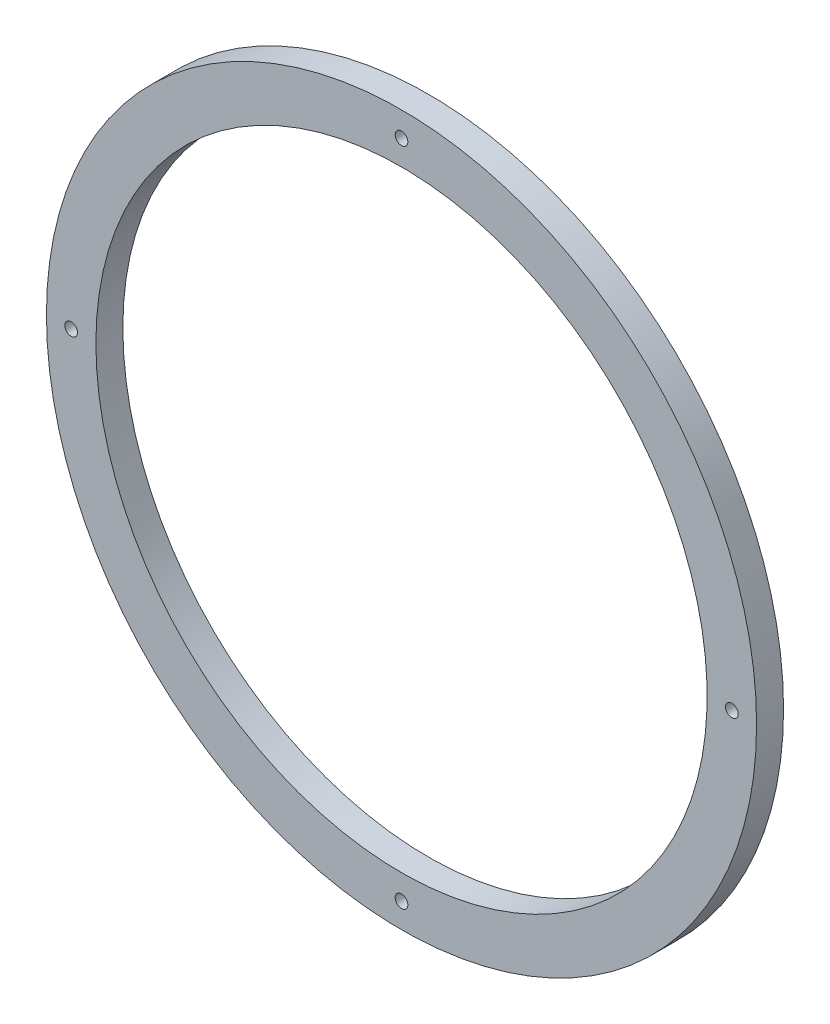
from build123d import *

# Parameters (mm, degrees)
SKETCH1_R           = 100.33
SKETCH1_R_2         = 86.36
SKETCH1_R_3         = 1.7859375
BOSS_EXTRUDE1_DEPTH = 7.62


with BuildPart() as part:
    # Sketch1 → Boss-Extrude1 (new body)
    with BuildSketch(Plane.XY):
        with Locations(Location((0, 0, 0), (0, 0, 180))):
            Circle(SKETCH1_R)
        with Locations(Location((0, 0, 0), (0, 0, 180))):
            Circle(SKETCH1_R_2, mode=Mode.SUBTRACT)
        with Locations(Location((0, 93.345, 0), (0, 0, 180))):
            Circle(SKETCH1_R_3, mode=Mode.SUBTRACT)
        with Locations(Location((93.345, 0, 0), (0, 0, 180))):
            Circle(SKETCH1_R_3, mode=Mode.SUBTRACT)
        with Locations(Location((0, -93.345, 0), (0, 0, 180))):
            Circle(SKETCH1_R_3, mode=Mode.SUBTRACT)
        with Locations(Location((-93.345, 0, 0), (0, 0, 180))):
            Circle(SKETCH1_R_3, mode=Mode.SUBTRACT)
    extrude(amount=BOSS_EXTRUDE1_DEPTH)


solid = part.part
